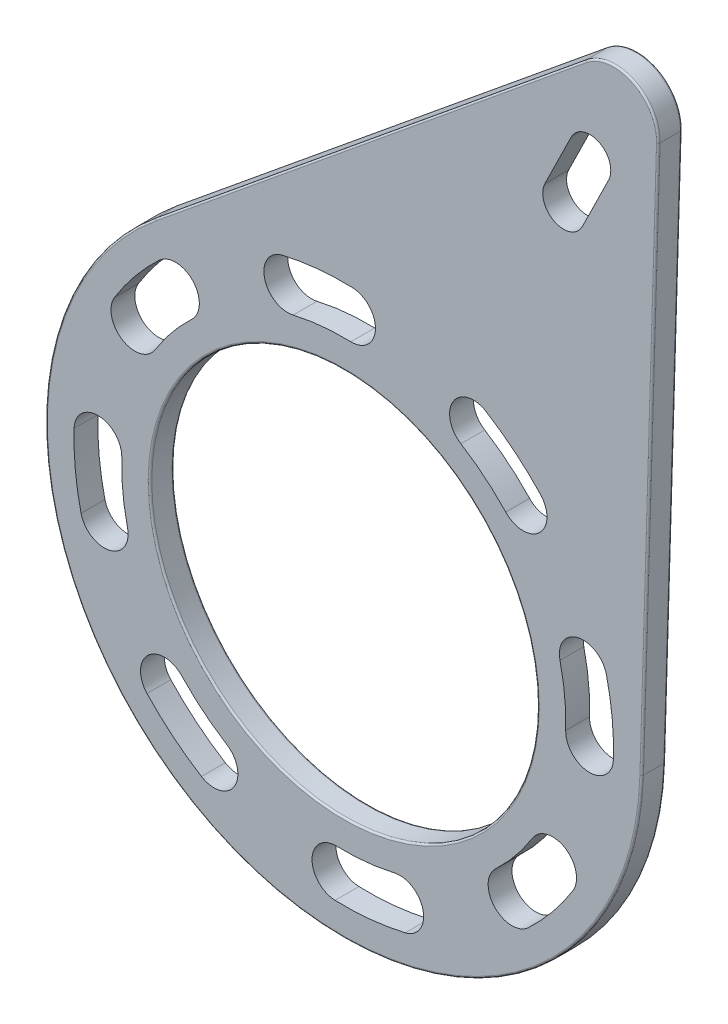
from build123d import *

# Parameters (mm, degrees)
SKETCH1_R           = 32.5
BOSS_EXTRUDE1_DEPTH = 4
FILLET1_R           = 0.3


with BuildPart() as part:
    # Sketch1 → Boss-Extrude1 (new body)
    with BuildSketch(Plane.XY):
        with BuildLine():
            Line((40.513754338, 97.768275578), (-31.667544375, 38.693237565))
            ThreePointArc((-31.667544375, 38.693237565), (-22.079944387, -44.860629241), (49.977742159, -1.491740146))
            Line((49.977742159, -1.491740146), (52.760547318, 91.740528921))
            ThreePointArc((52.760547318, 91.740528921), (48.575877652, 98.693384329), (40.513754338, 97.768275578))
        make_face()
        with BuildLine():
            Line((44.429740051, 82.343780573), (40.013751174, 73.371654725))
            ThreePointArc((40.013751174, 73.371654725), (35.32791102, 71.777006785), (33.73326308, 76.462846939))
            Line((33.73326308, 76.462846939), (38.149251957, 85.434972787))
            ThreePointArc((38.149251957, 85.434972787), (42.835092111, 87.029620727), (44.429740051, 82.343780573))
        make_face(mode=Mode.SUBTRACT)
        with BuildLine():
            ThreePointArc((27.168436627, 25.484084273), (23.609666403, 28.812256981), (19.646928241, 31.647443984))
            ThreePointArc((19.646928241, 31.647443984), (18.358282255, 37.155564491), (23.866402763, 38.444210477))
            ThreePointArc((23.866402763, 38.444210477), (28.680198785, 35.000124252), (33.003268654, 30.957176198))
            ThreePointArc((33.003268654, 30.957176198), (32.822398603, 25.303214222), (27.168436627, 25.484084273))
        make_face(mode=Mode.SUBTRACT)
        with BuildLine():
            ThreePointArc((-23.866402763, -38.444210477), (-28.680198785, -35.000124252), (-33.003268654, -30.957176198))
            ThreePointArc((-33.003268654, -30.957176198), (-32.822398603, -25.303214222), (-27.168436627, -25.484084273))
            ThreePointArc((-27.168436627, -25.484084273), (-23.609666403, -28.812256981), (-19.646928241, -31.647443984))
            ThreePointArc((-19.646928241, -31.647443984), (-18.358282255, -37.155564491), (-23.866402763, -38.444210477))
        make_face(mode=Mode.SUBTRACT)
        with BuildLine():
            ThreePointArc((-44.060257161, -10.30806669), (-45.028788248, -4.468862155), (-45.226864283, 1.446805851))
            ThreePointArc((-45.226864283, 1.446805851), (-41.101014989, 5.316866265), (-37.230954575, 1.191016971))
            ThreePointArc((-37.230954575, 1.191016971), (-37.067897508, -3.678787077), (-36.270598437, -8.485646059))
            ThreePointArc((-36.270598437, -8.485646059), (-39.254217484, -13.291685737), (-44.060257161, -10.30806669))
        make_face(mode=Mode.SUBTRACT)
        Circle(SKETCH1_R, mode=Mode.SUBTRACT)
        with BuildLine():
            ThreePointArc((10.30806669, -44.060257161), (4.468862155, -45.028788248), (-1.446805851, -45.226864283))
            ThreePointArc((-1.446805851, -45.226864283), (-5.316866265, -41.101014989), (-1.191016971, -37.230954575))
            ThreePointArc((-1.191016971, -37.230954575), (3.678787077, -37.067897508), (8.485646059, -36.270598437))
            ThreePointArc((8.485646059, -36.270598437), (13.291685737, -39.254217484), (10.30806669, -44.060257161))
        make_face(mode=Mode.SUBTRACT)
        with BuildLine():
            ThreePointArc((38.444210477, -23.866402763), (35.000124252, -28.680198785), (30.957176198, -33.003268654))
            ThreePointArc((30.957176198, -33.003268654), (25.303214222, -32.822398603), (25.484084273, -27.168436627))
            ThreePointArc((25.484084273, -27.168436627), (28.812256981, -23.609666403), (31.647443984, -19.646928241))
            ThreePointArc((31.647443984, -19.646928241), (37.155564491, -18.358282255), (38.444210477, -23.866402763))
        make_face(mode=Mode.SUBTRACT)
        with BuildLine():
            ThreePointArc((44.060257161, 10.30806669), (45.028788248, 4.468862155), (45.226864283, -1.446805851))
            ThreePointArc((45.226864283, -1.446805851), (41.101014989, -5.316866265), (37.230954575, -1.191016971))
            ThreePointArc((37.230954575, -1.191016971), (37.067897508, 3.678787077), (36.270598437, 8.485646059))
            ThreePointArc((36.270598437, 8.485646059), (39.254217484, 13.291685737), (44.060257161, 10.30806669))
        make_face(mode=Mode.SUBTRACT)
        with BuildLine():
            ThreePointArc((-38.444210477, 23.866402763), (-35.000124252, 28.680198785), (-30.957176198, 33.003268654))
            ThreePointArc((-30.957176198, 33.003268654), (-25.303214222, 32.822398603), (-25.484084273, 27.168436627))
            ThreePointArc((-25.484084273, 27.168436627), (-28.812256981, 23.609666403), (-31.647443984, 19.646928241))
            ThreePointArc((-31.647443984, 19.646928241), (-37.155564491, 18.358282255), (-38.444210477, 23.866402763))
        make_face(mode=Mode.SUBTRACT)
        with BuildLine():
            ThreePointArc((-10.30806669, 44.060257161), (-4.468862155, 45.028788248), (1.446805851, 45.226864283))
            ThreePointArc((1.446805851, 45.226864283), (5.316866265, 41.101014989), (1.191016971, 37.230954575))
            ThreePointArc((1.191016971, 37.230954575), (-3.678787077, 37.067897508), (-8.485646059, 36.270598437))
            ThreePointArc((-8.485646059, 36.270598437), (-13.291685737, 39.254217484), (-10.30806669, 44.060257161))
        make_face(mode=Mode.SUBTRACT)
    extrude(amount=BOSS_EXTRUDE1_DEPTH)

    # Fillet1
    fillet1_edges = [part.edges().sort_by_distance(p)[0] for p in [
        (-32.5, 0, 4),
        (48.575877652, 98.693384329, 4),
        (4.423104981, 68.230756572, 4),
        (-22.079944387, -44.860629241, 4),
        (51.369144738, 45.124394387, 4),
        (-32.5, 0, 0),
        (51.369144738, 45.124394387, 0),
        (-22.079944387, -44.860629241, 0),
        (4.423104981, 68.230756572, 0),
        (48.575877652, 98.693384329, 0),
    ]]
    fillet(fillet1_edges, radius=FILLET1_R)


solid = part.part
